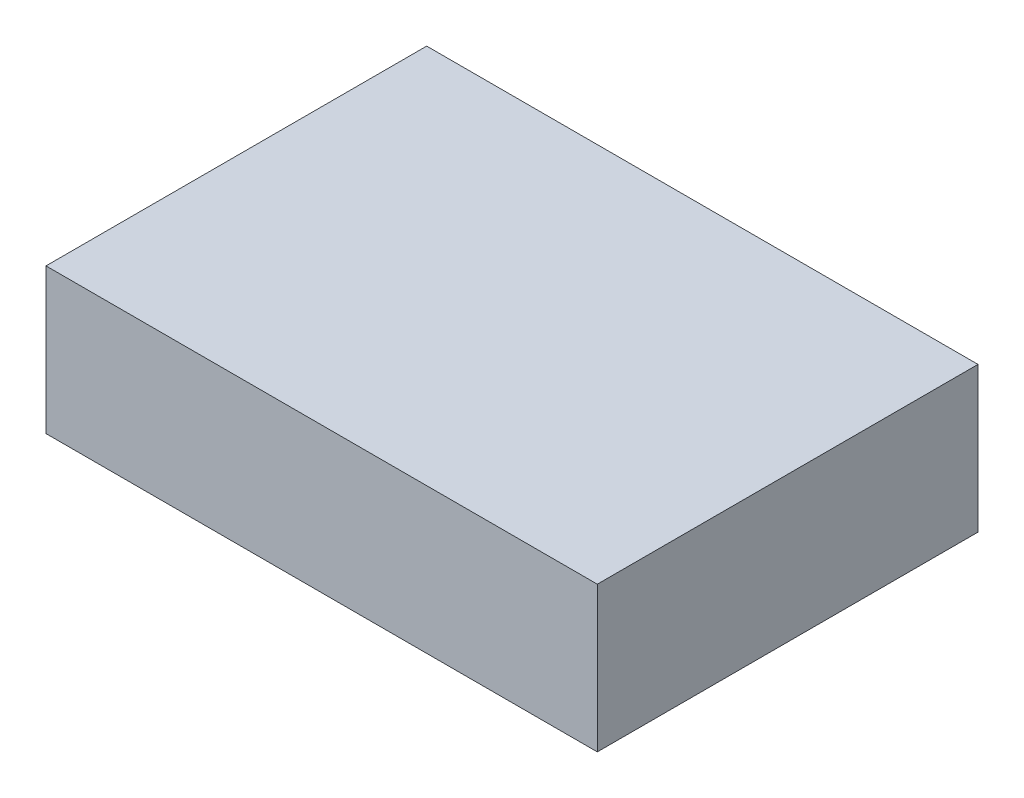
from build123d import *

# Parameters (mm, degrees)
SKETCH1_W           = 33.02
SKETCH1_H           = 22.8
BOSS_EXTRUDE1_DEPTH = 8.7


with BuildPart() as part:
    # Sketch1 → Boss-Extrude1 (new body)
    with BuildSketch(Plane(origin=(0, 0, 0), x_dir=(1, 0, 0), z_dir=(0, 1, 0))):
        Rectangle(SKETCH1_W, SKETCH1_H)
    extrude(amount=BOSS_EXTRUDE1_DEPTH)


solid = part.part
